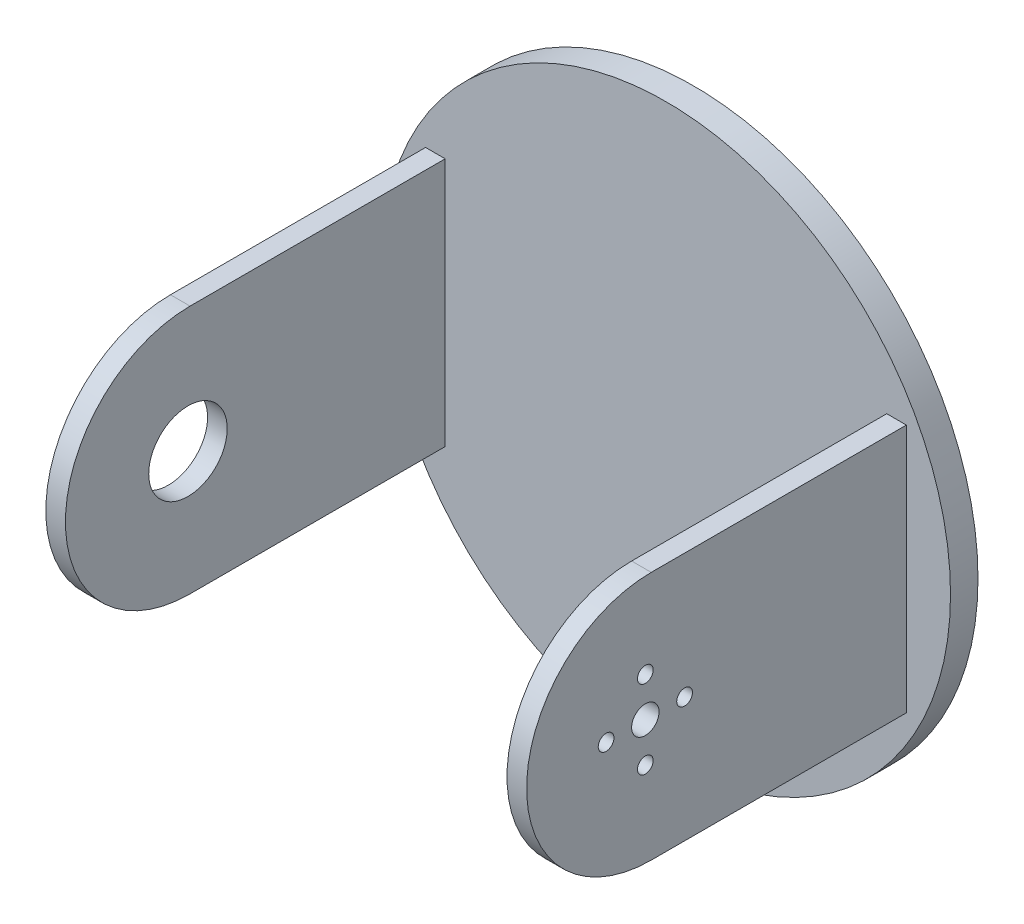
from build123d import *

# Parameters (mm, degrees)
SKETCH1_W             = 5
SKETCH1_H             = 63.5
BOSS_EXTRUDE1_DEPTH   = 65
BOSS_EXTRUDE1_2_DEPTH = 65
SKETCH1_4_R           = 72.5
BOSS_EXTRUDE2_DEPTH   = 7
BOSS_EXTRUDE3_DEPTH   = 5
BOSS_EXTRUDE4_START   = -5
BOSS_EXTRUDE4_DEPTH   = 5
SKETCH4_R             = 30
BOSS_EXTRUDE5_DEPTH   = 7
SKETCH5_R             = 32
BOSS_EXTRUDE6_DEPTH   = 2
SKETCH6_R             = 10
BOSS_EXTRUDE7_DEPTH   = 17
SKETCH13_R            = 3.5
SKETCH13_R_2          = 2
CUT_EXTRUDE3_DEPTH    = 5
SKETCH14_R            = 10
CUT_EXTRUDE4_DEPTH    = 5


with BuildPart() as part:
    # Sketch1 → Boss-Extrude1 (new body)
    with BuildSketch(Plane.XY):
        with Locations((58.75, 0)):
            Rectangle(SKETCH1_W, SKETCH1_H)
    extrude(amount=BOSS_EXTRUDE1_DEPTH)



with BuildPart() as body_2:
    # Sketch1 → Boss-Extrude1 2 (new body)
    with BuildSketch(Plane.XY):
        with Locations((-58.75, 0)):
            Rectangle(SKETCH1_W, SKETCH1_H)
    extrude(amount=BOSS_EXTRUDE1_2_DEPTH)


with BuildPart() as part_1:
    add(part.part)

    add(body_2.part)  # Boss-Extrude2 merges body 2
    # Sketch1<4> → Boss-Extrude2 (add)
    with BuildSketch(Plane.XY):
        Circle(SKETCH1_4_R)
    extrude(amount=-BOSS_EXTRUDE2_DEPTH)

    # Sketch2 → Boss-Extrude3 (add)
    with BuildSketch(Plane.ZY.offset(-56.25)):
        with BuildLine():
            Line((65, -31.75), (65, 31.75))
            ThreePointArc((65, 31.75), (96.75, 0), (65, -31.75))
        make_face()
    extrude(amount=-BOSS_EXTRUDE3_DEPTH)

    # Sketch3 → Boss-Extrude4 (add)
    with BuildSketch(Plane(origin=(-56.25, 0, 0), x_dir=(0, 0, -1), z_dir=(1, 0, 0)).offset(BOSS_EXTRUDE4_START)):
        with BuildLine():
            Line((-65, 31.75), (-65, -31.75))
            ThreePointArc((-65, -31.75), (-96.75, 0), (-65, 31.75))
        make_face()
    extrude(amount=BOSS_EXTRUDE4_DEPTH)

    # Sketch4 → Boss-Extrude5 (add)
    with BuildSketch(Plane(origin=(0, 0, -7), x_dir=(-1, 0, 0), z_dir=(0, 0, -1))):
        Circle(SKETCH4_R)
    extrude(amount=BOSS_EXTRUDE5_DEPTH)

    # Sketch5 → Boss-Extrude6 (add)
    with BuildSketch(Plane(origin=(0, 0, -14), x_dir=(-1, 0, 0), z_dir=(0, 0, -1))):
        Circle(SKETCH5_R)
    extrude(amount=BOSS_EXTRUDE6_DEPTH)

    # Sketch6 → Boss-Extrude7 (add)
    with BuildSketch(Plane(origin=(0, 0, -16), x_dir=(-1, 0, 0), z_dir=(0, 0, -1))):
        Circle(SKETCH6_R)
    extrude(amount=BOSS_EXTRUDE7_DEPTH)

    # Sketch13 → Cut-Extrude3 (cut)
    with BuildSketch(Plane(origin=(61.25, 0, 0), x_dir=(0, 0, -1), z_dir=(1, 0, 0))):
        with Locations((-66.505993966, 0)):
            Circle(SKETCH13_R)
        with Locations((-76.505993966, 0)):
            Circle(SKETCH13_R_2)
        with Locations((-66.505993966, -10)):
            Circle(SKETCH13_R_2)
        with Locations((-56.505993966, 0)):
            Circle(SKETCH13_R_2)
        with Locations((-66.505993966, 10)):
            Circle(SKETCH13_R_2)
    extrude(amount=-CUT_EXTRUDE3_DEPTH, mode=Mode.SUBTRACT)

    # Sketch14 → Cut-Extrude4 (cut)
    with BuildSketch(Plane.ZY.offset(61.25)):
        with Locations((65.530908604, 0)):
            Circle(SKETCH14_R)
    extrude(amount=-CUT_EXTRUDE4_DEPTH, mode=Mode.SUBTRACT)


solid = part_1.part
